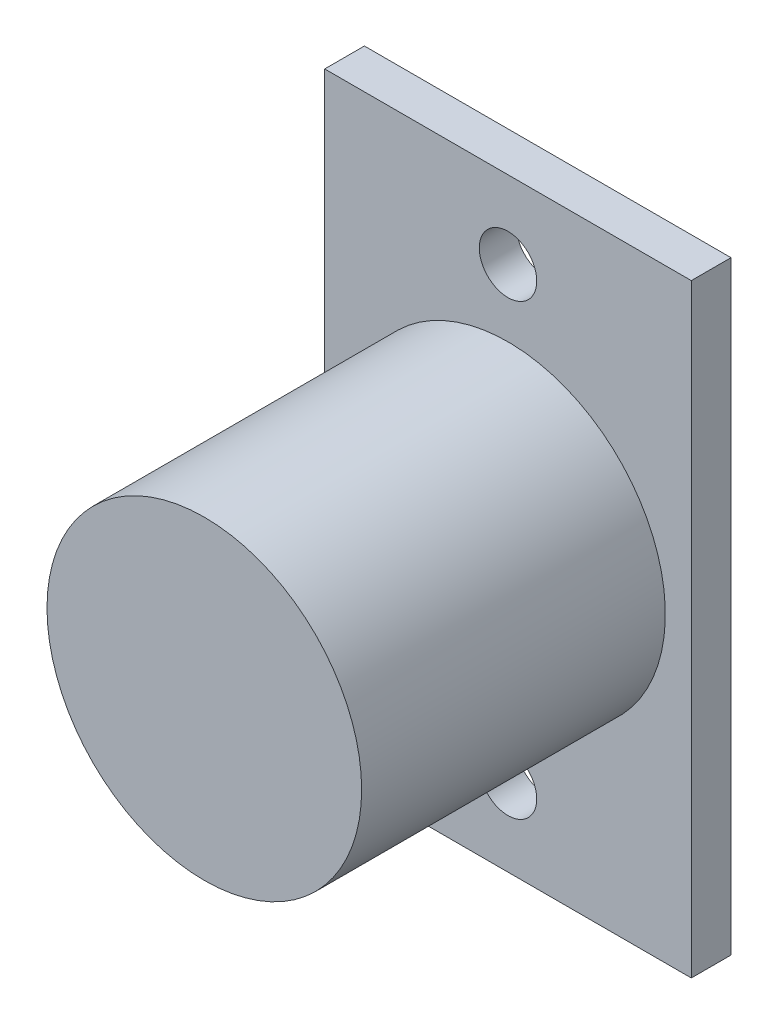
from build123d import *

# Parameters (mm, degrees)
SKETCH1_W           = 22.0472
SKETCH1_H           = 36.322
BOSS_EXTRUDE1_DEPTH = 2.3876
CUT_EXTRUDE1_REACH  = 44.557
SKETCH2_R           = 1.7272
SKETCH2_R_2         = 8.89
SKETCH3_R           = 9.4615
BOSS_EXTRUDE2_DEPTH = 18.2626
CHAMFER1_SIZE       = 1.1303
CHAMFER1_SIZE2      = 0.158853305


with BuildPart() as part:
    # Sketch1 → Boss-Extrude1 (new body)
    with BuildSketch(Plane.XY):
        with Locations((11.0236, 18.161)):
            Rectangle(SKETCH1_W, SKETCH1_H)
    extrude(amount=BOSS_EXTRUDE1_DEPTH)

    # Sketch2 → Cut-Extrude1 (cut, up to next)
    with BuildSketch(Plane(origin=(0, 0, 0), x_dir=(-1, 0, 0), z_dir=(0, 0, -1)), mode=Mode.PRIVATE) as cut_extrude1_sk1:
        with Locations((-11.0236, 31.6484)):
            Circle(SKETCH2_R)
    cut_extrude1_tool1 = extrude(cut_extrude1_sk1.sketch, amount=-CUT_EXTRUDE1_REACH, mode=Mode.PRIVATE) & part.part
    # Sketch2 → Cut-Extrude1 (cut, up to next)
    with BuildSketch(Plane(origin=(0, 0, 0), x_dir=(-1, 0, 0), z_dir=(0, 0, -1)), mode=Mode.PRIVATE) as cut_extrude1_sk2:
        with Locations((-11.0236, 4.6736)):
            Circle(SKETCH2_R)
    cut_extrude1_tool2 = extrude(cut_extrude1_sk2.sketch, amount=-CUT_EXTRUDE1_REACH, mode=Mode.PRIVATE) & part.part
    # Sketch2 → Cut-Extrude1 (cut, up to next)
    with BuildSketch(Plane(origin=(0, 0, 0), x_dir=(-1, 0, 0), z_dir=(0, 0, -1)), mode=Mode.PRIVATE) as cut_extrude1_sk3:
        with Locations((-11.0236, 18.161)):
            Circle(SKETCH2_R_2)
    cut_extrude1_tool3 = extrude(cut_extrude1_sk3.sketch, amount=-CUT_EXTRUDE1_REACH, mode=Mode.PRIVATE) & part.part
    add(cut_extrude1_tool1.solids().sort_by_distance((11.0236, 31.6484, 0))[0], mode=Mode.SUBTRACT)
    add(cut_extrude1_tool2.solids().sort_by_distance((11.0236, 4.6736, 0))[0], mode=Mode.SUBTRACT)
    add(cut_extrude1_tool3.solids().sort_by_distance((11.0236, 18.161, 0))[0], mode=Mode.SUBTRACT)

    # Sketch3 → Boss-Extrude2 (add)
    with BuildSketch(Plane.XY.offset(2.3876)):
        with Locations(Location((11.0236, 18.161, 0), (0, 0, 180))):
            Circle(SKETCH3_R)
    extrude(amount=BOSS_EXTRUDE2_DEPTH)

    # Chamfer1
    chamfer1_edges = [part.edges().sort_by_distance(p)[0] for p in [
        (12.7508, 31.6484, 0),
        (12.7508, 4.6736, 0),
    ]]
    chamfer1_side = [part.faces().sort_by_distance(p)[0] for p in [
        (11.0236, 0.424896071, 0),
    ]]
    chamfer(chamfer1_edges, length=CHAMFER1_SIZE, length2=CHAMFER1_SIZE2, reference=chamfer1_side[0])


solid = part.part
